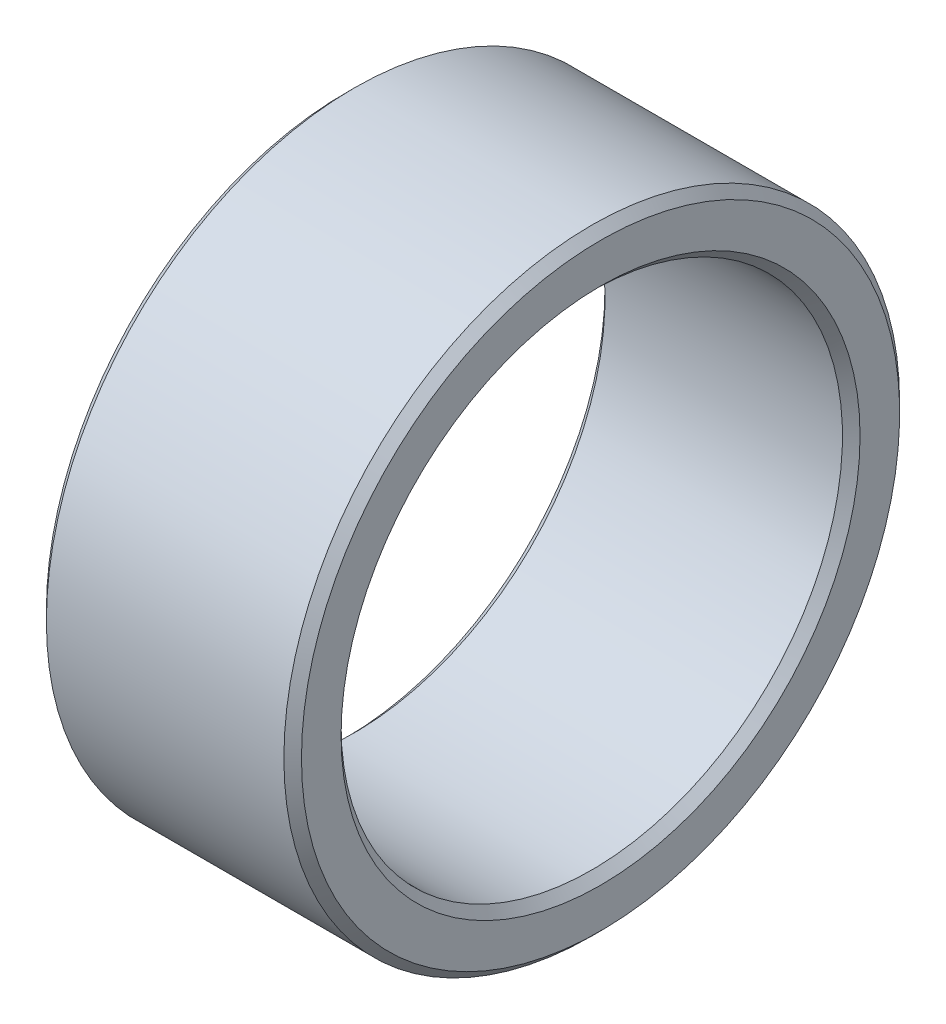
from build123d import *


with BuildPart() as part:
    # Skizze1 → Rotation1 (revolve)
    with BuildSketch(Plane.XY, mode=Mode.PRIVATE) as rotation1_sk:
        Polygon((8.4, 10.5), (8.7, 10.2), (8.7, 8.85), (8.4, 8.55), (0.3, 8.55), (0, 8.85), (0, 10.2), (0.3, 10.5), align=None)
    revolve(rotation1_sk.sketch.rotate(Axis((0, 0, 0), (1, 0, 0)), 90), axis=Axis((0, 0, 0), (1, 0, 0)))


solid = part.part
